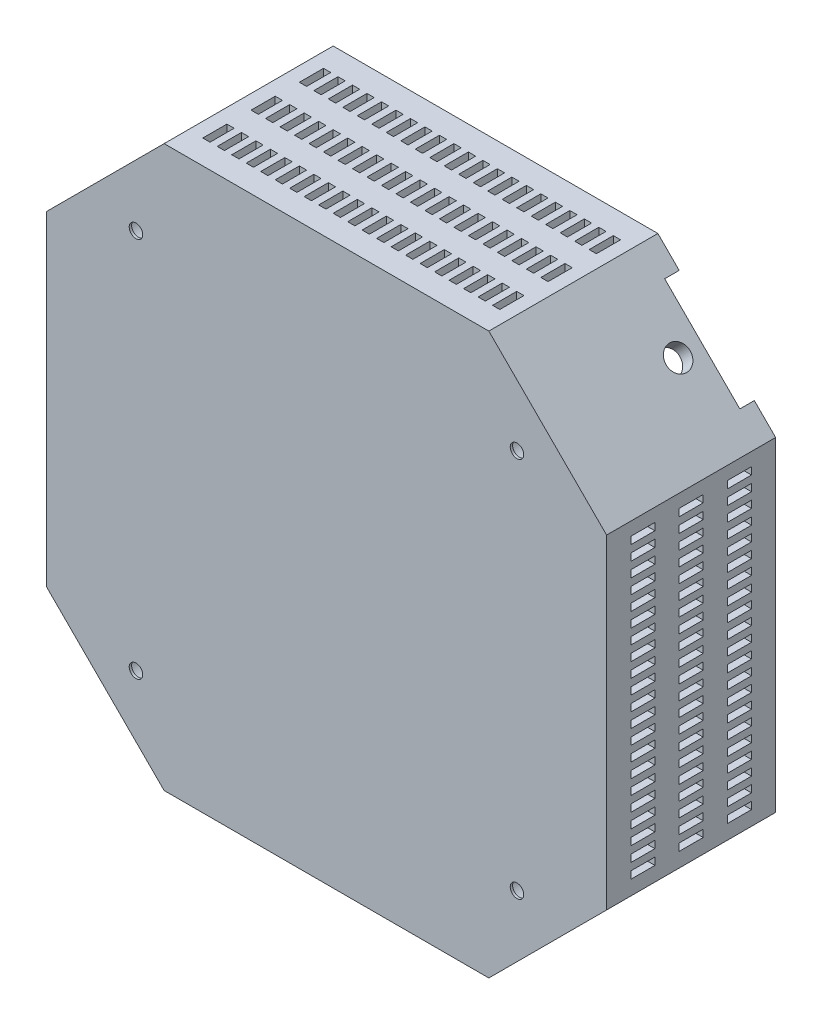
from build123d import *

# Parameters (mm, degrees)
ESQUISSE1_R                                = 1.4
BOSS_EXTRU_1_DEPTH                         = 3.5
ESQUISSE2_R                                = 3.25
ENL_V_MAT_EXTRU_1_DEPTH                    = 3
SYM_TRIE3_AT_THE_SECOND_PLANE_COPY_1_SKE_R = 3.25
SYM_TRIE3_AT_THE_SECOND_PLANE_COPY_1_DEPTH = 3
BOSS_EXTRU_2_DEPTH                         = 35
ENL_V_MAT_EXTRU_3_DEPTH                    = 3
ESQUISSE15_R                               = 2.5
ENL_V_MAT_EXTRU_4_DEPTH                    = 161.87601569
ESQUISSE16_W                               = 1.5
ESQUISSE16_H                               = 5
ENL_V_MAT_EXTRU_5_DEPTH                    = 159.342422119
ESQUISSE19_W                               = 5
ESQUISSE19_H                               = 1.5
ENL_V_MAT_EXTRU_6_DEPTH                    = 145.260871167


with BuildPart() as part:
    # Esquisse1 → Boss.-Extru.1 (new body)
    with BuildSketch(Plane(origin=(0, 0, -27.5), x_dir=(-1, 0, 0), z_dir=(0, 0, -1))):
        Polygon((-2.565563678, -55.727752809), (62.179602326, -55.727752809), (84.807019324, -33.100335811), (84.807019324, 31.644830193), (62.179602326, 54.272247191), (-2.565563678, 54.272247191), (-25.192980676, 31.644830193), (-25.192980676, -33.100335811), align=None)
        with Locations((-9.63663149, 38.715898005)):
            Circle(ESQUISSE1_R, mode=Mode.SUBTRACT)
        with Locations((69.250670138, 38.715898005)):
            Circle(ESQUISSE1_R, mode=Mode.SUBTRACT)
        with Locations((69.250670138, -40.171403623)):
            Circle(ESQUISSE1_R, mode=Mode.SUBTRACT)
        with Locations((-9.63663149, -40.171403623)):
            Circle(ESQUISSE1_R, mode=Mode.SUBTRACT)
    extrude(amount=BOSS_EXTRU_1_DEPTH)

    # Esquisse2 → Enlèv. mat.-Extru.1 (cut)
    with BuildSketch(Plane(origin=(0, 0, -31), x_dir=(-1, 0, 0), z_dir=(0, 0, -1))):
        with Locations((69.250670138, 38.715898005)):
            Circle(ESQUISSE2_R)
    enl_v_mat_extru_1 = extrude(amount=-ENL_V_MAT_EXTRU_1_DEPTH, mode=Mode.SUBTRACT)

    # Symétrie3: Enlèv. mat.-Extru.1 across plane
    add(enl_v_mat_extru_1.mirror(Plane(origin=(-29.807019324, 0, 0), x_dir=(0, 0, 1), z_dir=(1, 0, 0))), mode=Mode.SUBTRACT)

    # Symétrie3 at the second plane: Enlèv. mat.-Extru.1 across plane
    add(enl_v_mat_extru_1.mirror(Plane(origin=(0, -0.727752809, 0), x_dir=(0, 0, 1), z_dir=(0, -1, 0))), mode=Mode.SUBTRACT)

    # Symétrie3 at the second plane copy 1 ske → Symétrie3 at the second plane copy 1 (cut)
    with BuildSketch(Plane(origin=(-59.614038648, -1.455505618, -31), x_dir=(1, 0, 0), z_dir=(0, 0, -1))):
        with Locations((69.250670138, 38.715898005)):
            Circle(SYM_TRIE3_AT_THE_SECOND_PLANE_COPY_1_SKE_R)
    extrude(amount=-SYM_TRIE3_AT_THE_SECOND_PLANE_COPY_1_DEPTH, mode=Mode.SUBTRACT)

    # Esquisse12 → Boss.-Extru.2 (add)
    with BuildSketch(Plane.XY.offset(-27.5)):
        Polygon((-87.807019324, 32.88747088), (-63.422243013, 57.272247191), (3.808204365, 57.272247191), (28.192980676, 32.88747088), (28.192980676, -34.342976498), (3.808204365, -58.727752809), (-63.422243013, -58.727752809), (-87.807019324, -34.342976498), align=None)
        Polygon((2.565563678, -55.727752809), (25.192980676, -33.100335811), (25.192980676, 31.644830193), (2.565563678, 54.272247191), (-62.179602326, 54.272247191), (-84.807019324, 31.644830193), (-84.807019324, -33.100335811), (-62.179602326, -55.727752809), align=None, mode=Mode.SUBTRACT)
    extrude(amount=-BOSS_EXTRU_2_DEPTH)

    # Esquisse13 → Enlèv. mat.-Extru.3 (cut)
    with BuildSketch(Plane(origin=(0, 0, -62.5), x_dir=(-1, 0, 0), z_dir=(0, 0, -1))):
        Polygon((-23.778767114, 37.301684443), (-21.65744677, 35.180364099), (-6.101097584, 50.736713285), (-8.222417928, 52.858033629), align=None)
        Polygon((83.392805762, 37.301684443), (81.271485418, 35.180364099), (65.715136232, 50.736713285), (67.836456575, 52.858033629), align=None)
        Polygon((81.271485418, -36.635869717), (65.715136232, -52.192218903), (67.836456575, -54.313539247), (83.392805762, -38.757190061), align=None)
        Polygon((-6.101097584, -52.192218903), (-8.222417928, -54.313539247), (-23.778767114, -38.757190061), (-21.65744677, -36.635869717), align=None)
    extrude(amount=-ENL_V_MAT_EXTRU_3_DEPTH, mode=Mode.SUBTRACT)

    # Esquisse15 → Enlèv. mat.-Extru.4 (cut, through all)
    with BuildSketch(Plane(origin=(30.540225778, 30.540225778, 0), x_dir=(0, 0, -1), z_dir=(0.7071067811865475, 0.7071067811865477, 0))):
        with Locations(Location((54.5, 20.562146545, 0), (0, 0, 270))):
            Circle(ESQUISSE15_R)
    extrude(amount=-ENL_V_MAT_EXTRU_4_DEPTH, mode=Mode.SUBTRACT)

    # Esquisse16 → Enlèv. mat.-Extru.5 (cut, through all)
    with BuildSketch(Plane.XZ.offset(58.727752809)):
        with Locations((-59.672243013, -35)):
            Rectangle(ESQUISSE16_W, ESQUISSE16_H)
        with Locations((-56.672243013, -35)):
            Rectangle(ESQUISSE16_W, ESQUISSE16_H)
        with Locations((-53.672243013, -35)):
            Rectangle(ESQUISSE16_W, ESQUISSE16_H)
        with Locations((-50.672243013, -35)):
            Rectangle(ESQUISSE16_W, ESQUISSE16_H)
        with Locations((-47.672243013, -35)):
            Rectangle(ESQUISSE16_W, ESQUISSE16_H)
        with Locations((-44.672243013, -35)):
            Rectangle(ESQUISSE16_W, ESQUISSE16_H)
        with Locations((-41.672243013, -35)):
            Rectangle(ESQUISSE16_W, ESQUISSE16_H)
        with Locations((-38.672243013, -35)):
            Rectangle(ESQUISSE16_W, ESQUISSE16_H)
        with Locations((-35.672243013, -35)):
            Rectangle(ESQUISSE16_W, ESQUISSE16_H)
        with Locations((-32.672243013, -35)):
            Rectangle(ESQUISSE16_W, ESQUISSE16_H)
        with Locations((-29.672243013, -35)):
            Rectangle(ESQUISSE16_W, ESQUISSE16_H)
        with Locations((-26.672243013, -35)):
            Rectangle(ESQUISSE16_W, ESQUISSE16_H)
        with Locations((-23.672243013, -35)):
            Rectangle(ESQUISSE16_W, ESQUISSE16_H)
        with Locations((-20.672243013, -35)):
            Rectangle(ESQUISSE16_W, ESQUISSE16_H)
        with Locations((-17.672243013, -35)):
            Rectangle(ESQUISSE16_W, ESQUISSE16_H)
        with Locations((-14.672243013, -35)):
            Rectangle(ESQUISSE16_W, ESQUISSE16_H)
        with Locations((-11.672243013, -35)):
            Rectangle(ESQUISSE16_W, ESQUISSE16_H)
        with Locations((-8.672243013, -35)):
            Rectangle(ESQUISSE16_W, ESQUISSE16_H)
        with Locations((-5.672243013, -35)):
            Rectangle(ESQUISSE16_W, ESQUISSE16_H)
        with Locations((-2.672243013, -35)):
            Rectangle(ESQUISSE16_W, ESQUISSE16_H)
        with Locations((0.327756987, -35)):
            Rectangle(ESQUISSE16_W, ESQUISSE16_H)
        with Locations((-56.672243013, -45)):
            Rectangle(ESQUISSE16_W, ESQUISSE16_H)
        with Locations((-53.672243013, -45)):
            Rectangle(ESQUISSE16_W, ESQUISSE16_H)
        with Locations((-50.672243013, -45)):
            Rectangle(ESQUISSE16_W, ESQUISSE16_H)
        with Locations((-47.672243013, -45)):
            Rectangle(ESQUISSE16_W, ESQUISSE16_H)
        with Locations((-44.672243013, -45)):
            Rectangle(ESQUISSE16_W, ESQUISSE16_H)
        with Locations((-41.672243013, -45)):
            Rectangle(ESQUISSE16_W, ESQUISSE16_H)
        with Locations((-38.672243013, -45)):
            Rectangle(ESQUISSE16_W, ESQUISSE16_H)
        with Locations((-35.672243013, -45)):
            Rectangle(ESQUISSE16_W, ESQUISSE16_H)
        with Locations((-32.672243013, -45)):
            Rectangle(ESQUISSE16_W, ESQUISSE16_H)
        with Locations((-29.672243013, -45)):
            Rectangle(ESQUISSE16_W, ESQUISSE16_H)
        with Locations((-26.672243013, -45)):
            Rectangle(ESQUISSE16_W, ESQUISSE16_H)
        with Locations((-23.672243013, -45)):
            Rectangle(ESQUISSE16_W, ESQUISSE16_H)
        with Locations((-20.672243013, -45)):
            Rectangle(ESQUISSE16_W, ESQUISSE16_H)
        with Locations((-17.672243013, -45)):
            Rectangle(ESQUISSE16_W, ESQUISSE16_H)
        with Locations((-14.672243013, -45)):
            Rectangle(ESQUISSE16_W, ESQUISSE16_H)
        with Locations((-11.672243013, -45)):
            Rectangle(ESQUISSE16_W, ESQUISSE16_H)
        with Locations((-8.672243013, -45)):
            Rectangle(ESQUISSE16_W, ESQUISSE16_H)
        with Locations((-5.672243013, -45)):
            Rectangle(ESQUISSE16_W, ESQUISSE16_H)
        with Locations((-2.672243013, -45)):
            Rectangle(ESQUISSE16_W, ESQUISSE16_H)
        with Locations((0.327756987, -45)):
            Rectangle(ESQUISSE16_W, ESQUISSE16_H)
        with Locations((-56.672243013, -55)):
            Rectangle(ESQUISSE16_W, ESQUISSE16_H)
        with Locations((-53.672243013, -55)):
            Rectangle(ESQUISSE16_W, ESQUISSE16_H)
        with Locations((-50.672243013, -55)):
            Rectangle(ESQUISSE16_W, ESQUISSE16_H)
        with Locations((-47.672243013, -55)):
            Rectangle(ESQUISSE16_W, ESQUISSE16_H)
        with Locations((-44.672243013, -55)):
            Rectangle(ESQUISSE16_W, ESQUISSE16_H)
        with Locations((-41.672243013, -55)):
            Rectangle(ESQUISSE16_W, ESQUISSE16_H)
        with Locations((-38.672243013, -55)):
            Rectangle(ESQUISSE16_W, ESQUISSE16_H)
        with Locations((-35.672243013, -55)):
            Rectangle(ESQUISSE16_W, ESQUISSE16_H)
        with Locations((-32.672243013, -55)):
            Rectangle(ESQUISSE16_W, ESQUISSE16_H)
        with Locations((-29.672243013, -55)):
            Rectangle(ESQUISSE16_W, ESQUISSE16_H)
        with Locations((-26.672243013, -55)):
            Rectangle(ESQUISSE16_W, ESQUISSE16_H)
        with Locations((-23.672243013, -55)):
            Rectangle(ESQUISSE16_W, ESQUISSE16_H)
        with Locations((-20.672243013, -55)):
            Rectangle(ESQUISSE16_W, ESQUISSE16_H)
        with Locations((-17.672243013, -55)):
            Rectangle(ESQUISSE16_W, ESQUISSE16_H)
        with Locations((-14.672243013, -55)):
            Rectangle(ESQUISSE16_W, ESQUISSE16_H)
        with Locations((-11.672243013, -55)):
            Rectangle(ESQUISSE16_W, ESQUISSE16_H)
        with Locations((-8.672243013, -55)):
            Rectangle(ESQUISSE16_W, ESQUISSE16_H)
        with Locations((-5.672243013, -55)):
            Rectangle(ESQUISSE16_W, ESQUISSE16_H)
        with Locations((-2.672243013, -55)):
            Rectangle(ESQUISSE16_W, ESQUISSE16_H)
        with Locations((0.327756987, -55)):
            Rectangle(ESQUISSE16_W, ESQUISSE16_H)
        with Locations((-59.672243013, -45)):
            Rectangle(ESQUISSE16_W, ESQUISSE16_H)
        with Locations((-59.672243013, -55)):
            Rectangle(ESQUISSE16_W, ESQUISSE16_H)
    extrude(amount=-ENL_V_MAT_EXTRU_5_DEPTH, mode=Mode.SUBTRACT)

    # Esquisse19 → Enlèv. mat.-Extru.6 (cut, through all)
    with BuildSketch(Plane(origin=(28.192980676, 0, 0), x_dir=(0, 0, -1), z_dir=(1, 0, 0))):
        with Locations((35, -30.592976498)):
            Rectangle(ESQUISSE19_W, ESQUISSE19_H)
        with Locations((45, -30.592976498)):
            Rectangle(ESQUISSE19_W, ESQUISSE19_H)
        with Locations((55, -30.592976498)):
            Rectangle(ESQUISSE19_W, ESQUISSE19_H)
        with Locations((45, -27.592976498)):
            Rectangle(ESQUISSE19_W, ESQUISSE19_H)
        with Locations((55, -27.592976498)):
            Rectangle(ESQUISSE19_W, ESQUISSE19_H)
        with Locations((45, -24.592976498)):
            Rectangle(ESQUISSE19_W, ESQUISSE19_H)
        with Locations((55, -24.592976498)):
            Rectangle(ESQUISSE19_W, ESQUISSE19_H)
        with Locations((45, -21.592976498)):
            Rectangle(ESQUISSE19_W, ESQUISSE19_H)
        with Locations((55, -21.592976498)):
            Rectangle(ESQUISSE19_W, ESQUISSE19_H)
        with Locations((45, -18.592976498)):
            Rectangle(ESQUISSE19_W, ESQUISSE19_H)
        with Locations((55, -18.592976498)):
            Rectangle(ESQUISSE19_W, ESQUISSE19_H)
        with Locations((45, -15.592976498)):
            Rectangle(ESQUISSE19_W, ESQUISSE19_H)
        with Locations((55, -15.592976498)):
            Rectangle(ESQUISSE19_W, ESQUISSE19_H)
        with Locations((45, -12.592976498)):
            Rectangle(ESQUISSE19_W, ESQUISSE19_H)
        with Locations((55, -12.592976498)):
            Rectangle(ESQUISSE19_W, ESQUISSE19_H)
        with Locations((45, -9.592976498)):
            Rectangle(ESQUISSE19_W, ESQUISSE19_H)
        with Locations((55, -9.592976498)):
            Rectangle(ESQUISSE19_W, ESQUISSE19_H)
        with Locations((45, -6.592976498)):
            Rectangle(ESQUISSE19_W, ESQUISSE19_H)
        with Locations((55, -6.592976498)):
            Rectangle(ESQUISSE19_W, ESQUISSE19_H)
        with Locations((45, -3.592976498)):
            Rectangle(ESQUISSE19_W, ESQUISSE19_H)
        with Locations((55, -3.592976498)):
            Rectangle(ESQUISSE19_W, ESQUISSE19_H)
        with Locations((45, -0.592976498)):
            Rectangle(ESQUISSE19_W, ESQUISSE19_H)
        with Locations((55, -0.592976498)):
            Rectangle(ESQUISSE19_W, ESQUISSE19_H)
        with Locations((45, 2.407023502)):
            Rectangle(ESQUISSE19_W, ESQUISSE19_H)
        with Locations((55, 2.407023502)):
            Rectangle(ESQUISSE19_W, ESQUISSE19_H)
        with Locations((45, 5.407023502)):
            Rectangle(ESQUISSE19_W, ESQUISSE19_H)
        with Locations((55, 5.407023502)):
            Rectangle(ESQUISSE19_W, ESQUISSE19_H)
        with Locations((45, 8.407023502)):
            Rectangle(ESQUISSE19_W, ESQUISSE19_H)
        with Locations((55, 8.407023502)):
            Rectangle(ESQUISSE19_W, ESQUISSE19_H)
        with Locations((45, 11.407023502)):
            Rectangle(ESQUISSE19_W, ESQUISSE19_H)
        with Locations((55, 11.407023502)):
            Rectangle(ESQUISSE19_W, ESQUISSE19_H)
        with Locations((45, 14.407023502)):
            Rectangle(ESQUISSE19_W, ESQUISSE19_H)
        with Locations((55, 14.407023502)):
            Rectangle(ESQUISSE19_W, ESQUISSE19_H)
        with Locations((45, 17.407023502)):
            Rectangle(ESQUISSE19_W, ESQUISSE19_H)
        with Locations((55, 17.407023502)):
            Rectangle(ESQUISSE19_W, ESQUISSE19_H)
        with Locations((45, 20.407023502)):
            Rectangle(ESQUISSE19_W, ESQUISSE19_H)
        with Locations((55, 20.407023502)):
            Rectangle(ESQUISSE19_W, ESQUISSE19_H)
        with Locations((45, 23.407023502)):
            Rectangle(ESQUISSE19_W, ESQUISSE19_H)
        with Locations((55, 23.407023502)):
            Rectangle(ESQUISSE19_W, ESQUISSE19_H)
        with Locations((45, 26.407023502)):
            Rectangle(ESQUISSE19_W, ESQUISSE19_H)
        with Locations((55, 26.407023502)):
            Rectangle(ESQUISSE19_W, ESQUISSE19_H)
        with Locations((45, 29.407023502)):
            Rectangle(ESQUISSE19_W, ESQUISSE19_H)
        with Locations((55, 29.407023502)):
            Rectangle(ESQUISSE19_W, ESQUISSE19_H)
        with Locations((35, -27.592976498)):
            Rectangle(ESQUISSE19_W, ESQUISSE19_H)
        with Locations((35, -24.592976498)):
            Rectangle(ESQUISSE19_W, ESQUISSE19_H)
        with Locations((35, -21.592976498)):
            Rectangle(ESQUISSE19_W, ESQUISSE19_H)
        with Locations((35, -18.592976498)):
            Rectangle(ESQUISSE19_W, ESQUISSE19_H)
        with Locations((35, -15.592976498)):
            Rectangle(ESQUISSE19_W, ESQUISSE19_H)
        with Locations((35, -12.592976498)):
            Rectangle(ESQUISSE19_W, ESQUISSE19_H)
        with Locations((35, -9.592976498)):
            Rectangle(ESQUISSE19_W, ESQUISSE19_H)
        with Locations((35, -6.592976498)):
            Rectangle(ESQUISSE19_W, ESQUISSE19_H)
        with Locations((35, -3.592976498)):
            Rectangle(ESQUISSE19_W, ESQUISSE19_H)
        with Locations((35, -0.592976498)):
            Rectangle(ESQUISSE19_W, ESQUISSE19_H)
        with Locations((35, 2.407023502)):
            Rectangle(ESQUISSE19_W, ESQUISSE19_H)
        with Locations((35, 5.407023502)):
            Rectangle(ESQUISSE19_W, ESQUISSE19_H)
        with Locations((35, 8.407023502)):
            Rectangle(ESQUISSE19_W, ESQUISSE19_H)
        with Locations((35, 11.407023502)):
            Rectangle(ESQUISSE19_W, ESQUISSE19_H)
        with Locations((35, 14.407023502)):
            Rectangle(ESQUISSE19_W, ESQUISSE19_H)
        with Locations((35, 17.407023502)):
            Rectangle(ESQUISSE19_W, ESQUISSE19_H)
        with Locations((35, 20.407023502)):
            Rectangle(ESQUISSE19_W, ESQUISSE19_H)
        with Locations((35, 23.407023502)):
            Rectangle(ESQUISSE19_W, ESQUISSE19_H)
        with Locations((35, 26.407023502)):
            Rectangle(ESQUISSE19_W, ESQUISSE19_H)
        with Locations((35, 29.407023502)):
            Rectangle(ESQUISSE19_W, ESQUISSE19_H)
    extrude(amount=-ENL_V_MAT_EXTRU_6_DEPTH, mode=Mode.SUBTRACT)


solid = part.part
